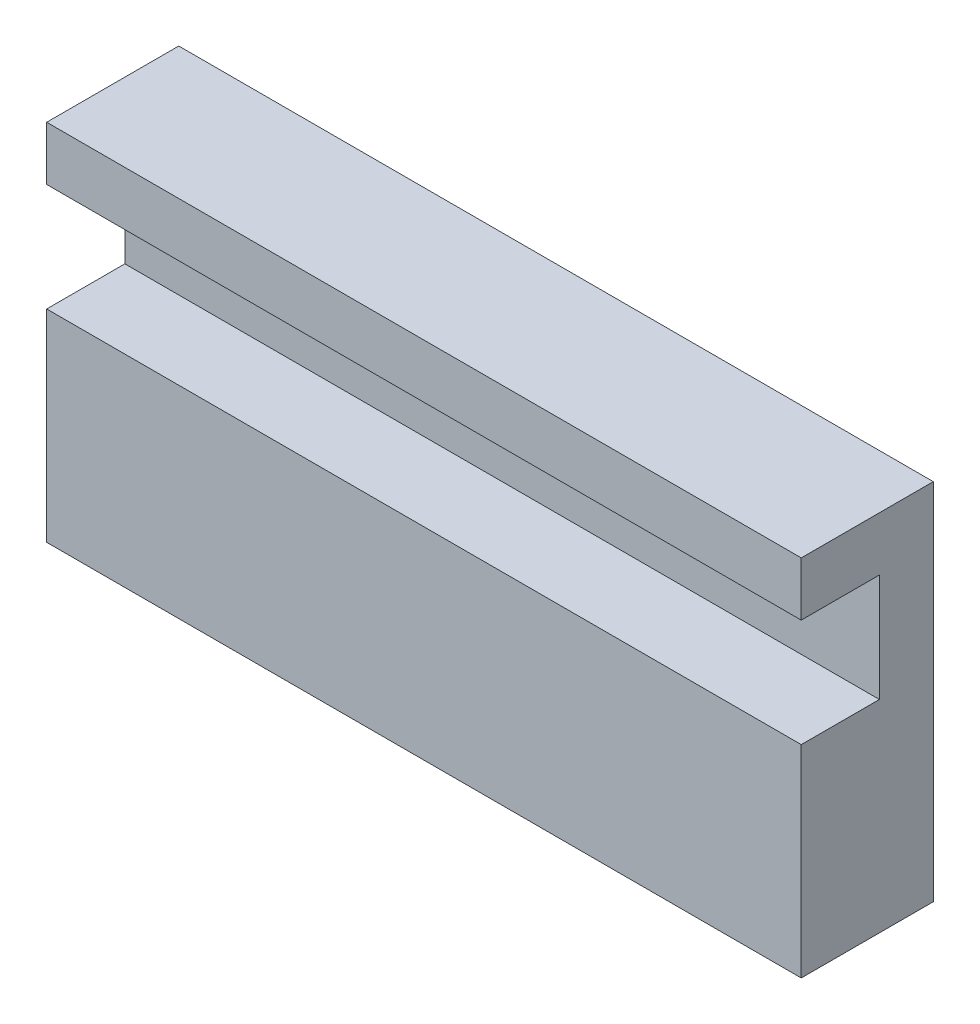
from build123d import *

# Parameters (mm, degrees)
SKETCH1_W           = 27.99800038
SKETCH1_H           = 15
BOSS_EXTRUDE1_DEPTH = 4.9
SKETCH3_W           = 3.40799886
SKETCH3_H           = 3.410000155
SKETCH3_W_2         = 2.90799886
SKETCH3_H_2         = 2.910000155
SKETCH3_W_3         = 3.409995615
SKETCH3_H_3         = 3.468000248
SKETCH3_W_4         = 2.909995615
SKETCH3_H_4         = 2.968000248
CUT_EXTRUDE1_DEPTH  = 5.5
SKETCH4_W           = 2.9
SKETCH4_H           = 4
CUT_EXTRUDE2_DEPTH  = 30.5
SKETCH5_W           = 27.99800038
SKETCH5_H           = 4.9
CUT_EXTRUDE3_DEPTH  = 1.5


with BuildPart() as part:
    # Sketch1 → Boss-Extrude1 (new body)
    with BuildSketch(Plane.XY):
        with Locations((13.99900019, 7.5)):
            Rectangle(SKETCH1_W, SKETCH1_H)
    extrude(amount=BOSS_EXTRUDE1_DEPTH)

    # Sketch3 → Cut-Extrude1 (cut)
    # profile 1 of 4: a face of its own
    with BuildSketch(Plane.XZ):
        with Locations((22.329997268, 2.772999986)):
            Rectangle(SKETCH3_W, SKETCH3_H)
        with Locations((22.329997268, 2.772999986)):
            Rectangle(SKETCH3_W_2, SKETCH3_H_2, mode=Mode.SUBTRACT)
    # profile 2 of 4: a face of its own
    with BuildSketch(Plane.XZ):
        with Locations((22.329997268, 2.772999986)):
            Rectangle(SKETCH3_W_2, SKETCH3_H_2)
    # profile 3 of 4: a face of its own
    with BuildSketch(Plane.XZ):
        with Locations((4.200998691, 2.770000137)):
            Rectangle(SKETCH3_W_3, SKETCH3_H_3)
        with Locations((4.200998691, 2.770000137)):
            Rectangle(SKETCH3_W_4, SKETCH3_H_4, mode=Mode.SUBTRACT)
    # profile 4 of 4: a face of its own
    with BuildSketch(Plane.XZ):
        with Locations((4.200998691, 2.770000137)):
            Rectangle(SKETCH3_W_4, SKETCH3_H_4)
    extrude(amount=-CUT_EXTRUDE1_DEPTH, mode=Mode.SUBTRACT)

    # Sketch4 → Cut-Extrude2 (cut)
    with BuildSketch(Plane(origin=(27.99800038, 0, 0), x_dir=(0, 0, -1), z_dir=(1, 0, 0))):
        with Locations((-3.45, 9.5)):
            Rectangle(SKETCH4_W, SKETCH4_H)
    extrude(amount=-CUT_EXTRUDE2_DEPTH, mode=Mode.SUBTRACT)

    # Sketch5 → Cut-Extrude3 (cut)
    with BuildSketch(Plane(origin=(0, 15, 0), x_dir=(1, 0, 0), z_dir=(0, 1, 0))):
        with Locations((13.99900019, -2.45)):
            Rectangle(SKETCH5_W, SKETCH5_H)
    extrude(amount=-CUT_EXTRUDE3_DEPTH, mode=Mode.SUBTRACT)


solid = part.part
